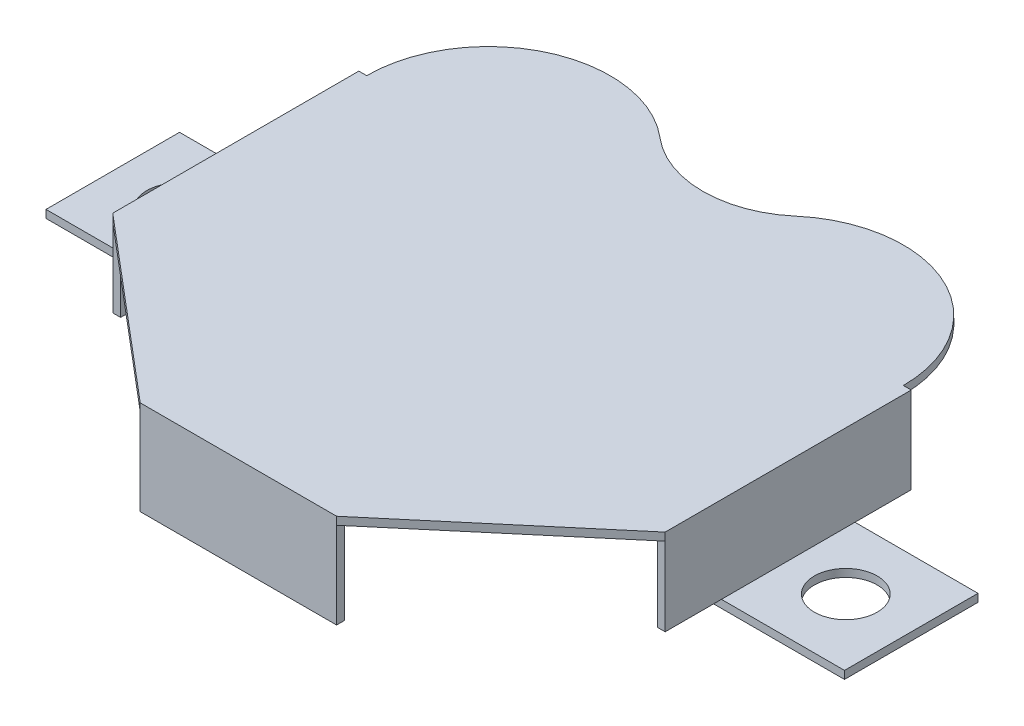
from build123d import *

# Parameters (mm, degrees)
SKETCH1_W             = 5
SKETCH1_H             = 5.1
SKETCH1_R             = 1.2
BOSS_EXTRUDE1_DEPTH   = 0.3
BOSS_EXTRUDE1_2_DEPTH = 0.3
SKETCH1_W_2           = 7.5
SKETCH1_H_2           = 0.3
BOSS_EXTRUDE1_3_DEPTH = 0.3
SKETCH2_W             = 0.3
SKETCH2_H             = 9.4
SKETCH2_W_2           = 7.5
SKETCH2_H_2           = 0.3
BOSS_EXTRUDE2_DEPTH   = 3
BOSS_EXTRUDE3_DEPTH   = 0.3


with BuildPart() as part:
    # Sketch1 → Boss-Extrude1 (new body)
    with BuildSketch(Plane(origin=(0, 0, 0), x_dir=(1, 0, 0), z_dir=(0, 1, 0))):
        with Locations((-12.75, 0)):
            Rectangle(SKETCH1_W, SKETCH1_H)
        with Locations(Location((-12.75, 0, 0), (0, 0, 270))):
            Circle(SKETCH1_R, mode=Mode.SUBTRACT)
    extrude(amount=BOSS_EXTRUDE1_DEPTH)



with BuildPart() as body_2:
    # Sketch1 → Boss-Extrude1 2 (new body)
    with BuildSketch(Plane(origin=(0, 0, 0), x_dir=(1, 0, 0), z_dir=(0, 1, 0))):
        with Locations((12.75, 0)):
            Rectangle(SKETCH1_W, SKETCH1_H)
        with Locations(Location((12.75, 0, 0), (0, 0, 270))):
            Circle(SKETCH1_R, mode=Mode.SUBTRACT)
    extrude(amount=BOSS_EXTRUDE1_2_DEPTH)


with BuildPart() as body_3:
    # Sketch1 → Boss-Extrude1 3 (new body)
    with BuildSketch(Plane(origin=(0, 0, 0), x_dir=(1, 0, 0), z_dir=(0, 1, 0))):
        with Locations((0, -10.3)):
            Rectangle(SKETCH1_W_2, SKETCH1_H_2)
    extrude(amount=BOSS_EXTRUDE1_3_DEPTH)


with BuildPart() as part_1:
    add(part.part)

    add(body_2.part)  # Boss-Extrude2 merges body 2

    add(body_3.part)  # Boss-Extrude2 merges body 3
    # Sketch2 → Boss-Extrude2 (add)
    with BuildSketch(Plane(origin=(0, 0.3, 0), x_dir=(1, 0, 0), z_dir=(0, 1, 0))):
        with Locations((-10.4, 0)):
            Rectangle(SKETCH2_W, SKETCH2_H)
        with Locations((10.4, 0)):
            Rectangle(SKETCH2_W, SKETCH2_H)
        with Locations((0, -10.3)):
            Rectangle(SKETCH2_W_2, SKETCH2_H_2)
    extrude(amount=BOSS_EXTRUDE2_DEPTH)

    # Sketch3 → Boss-Extrude3 (add)
    with BuildSketch(Plane(origin=(0, 3.3, 0), x_dir=(1, 0, 0), z_dir=(0, 1, 0))):
        with BuildLine():
            Line((-3.75, -10.45), (-10.55, -4.7))
            Line((-10.55, -4.7), (-10.55, 4.7))
            Line((-10.55, 4.7), (-10.25, 4.7))
            ThreePointArc((-10.25, 4.7), (-7.551234557, 8.92080368), (-2.587555397, 8.242270108))
            ThreePointArc((-2.587555397, 8.242270108), (0, 7.290779594), (2.587555397, 8.242270108))
            ThreePointArc((2.587555397, 8.242270108), (7.551234557, 8.92080368), (10.25, 4.7))
            Line((10.25, 4.7), (10.55, 4.7))
            Line((10.55, 4.7), (10.55, -4.7))
            Line((10.55, -4.7), (3.75, -10.45))
            Line((3.75, -10.45), (-3.75, -10.45))
        make_face()
    extrude(amount=BOSS_EXTRUDE3_DEPTH)


solid = part_1.part
